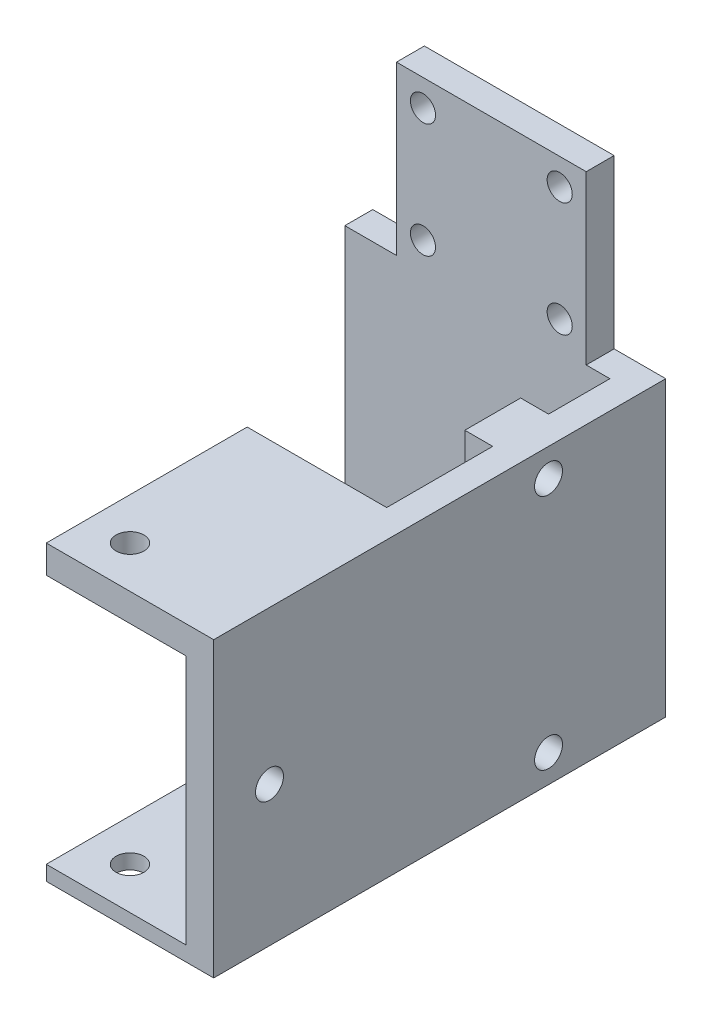
from build123d import *

# Parameters (mm, degrees)
SKETCH1_R               = 2.25
BOSS_EXTRUDE1_DEPTH     = 5
SKETCH2_W               = 52.5
SKETCH2_H               = 52.5
SKETCH2_W_2             = 42.5
SKETCH2_H_2             = 42.5
BOSS_EXTRUDE2_DEPTH     = 40
BOSS_EXTRUDE3_DEPTH     = 36
CUT_EXTRUDE2_DEPTH      = 121.157448791
CUT_EXTRUDE2_DEPTH_BACK = 121.157448791
SKETCH6_R               = 2.5
CUT_EXTRUDE3_DEPTH      = 149.234611343
CUT_EXTRUDE3_DEPTH_BACK = 149.234611343
SKETCH7_R               = 2.5
SKETCH8_W               = 40
SKETCH8_H               = 36.5
CUT_EXTRUDE4_DEPTH      = 24
SKETCH9_W               = 25
SKETCH9_H               = 25.519409936
CUT_EXTRUDE5_DEPTH      = 2.35
SKETCH10_W              = 5
SKETCH10_H              = 30
CUT_EXTRUDE6_DEPTH      = 119
SKETCH11_W              = 40
SKETCH11_H              = 52.5
CUT_EXTRUDE7_DEPTH      = 47.5
SKETCH12_R              = 2.5
CUT_EXTRUDE8_DEPTH      = 119
BOSS_EXTRUDE4_START     = 5
SKETCH13_W              = 10
SKETCH13_H              = 52.5
SKETCH13_R              = 2.5
BOSS_EXTRUDE4_DEPTH     = 5


with BuildPart() as part:
    # Sketch1 → Boss-Extrude1 (new body)
    with BuildSketch(Plane.XY):
        Polygon((0, 30), (-9.25, 30), (-9.25, 82.5), (0, 82.5), (0, 112.5), (34, 112.5), (34, 82.5), (43.25, 82.5), (43.25, 30), (34, 30), (34, 0), (0, 0), align=None)
        with Locations((4.75, 25.25)):
            Circle(SKETCH1_R, mode=Mode.SUBTRACT)
        with Locations((29.25, 25.25)):
            Circle(SKETCH1_R, mode=Mode.SUBTRACT)
        with Locations((29.25, 4.75)):
            Circle(SKETCH1_R, mode=Mode.SUBTRACT)
        with Locations((4.75, 4.75)):
            Circle(SKETCH1_R, mode=Mode.SUBTRACT)
        with Locations((4.75, 107.75)):
            Circle(SKETCH1_R, mode=Mode.SUBTRACT)
        with Locations((29.25, 107.75)):
            Circle(SKETCH1_R, mode=Mode.SUBTRACT)
        with Locations((29.25, 87.25)):
            Circle(SKETCH1_R, mode=Mode.SUBTRACT)
        with Locations((4.75, 87.25)):
            Circle(SKETCH1_R, mode=Mode.SUBTRACT)
    extrude(amount=BOSS_EXTRUDE1_DEPTH)

    # Sketch2 → Boss-Extrude2 (add)
    with BuildSketch(Plane.XY.offset(5)):
        with Locations((17, 56.25)):
            Rectangle(SKETCH2_W, SKETCH2_H)
        with Locations((17, 56.25)):
            Rectangle(SKETCH2_W_2, SKETCH2_H_2, mode=Mode.SUBTRACT)
    extrude(amount=BOSS_EXTRUDE2_DEPTH)

    # Sketch5 → Boss-Extrude3 (add)
    with BuildSketch(Plane.XY.offset(45)):
        Polygon((43.25, 82.5), (43.25, 30), (13.25, 30), (13.25, 35), (38.25, 35), (38.25, 77.5), (13.25, 77.5), (13.25, 82.5), align=None)
    extrude(amount=BOSS_EXTRUDE3_DEPTH)

    # Sketch6 → Cut-Extrude2 (cut, two sides: drawn at the far end of the back side and taken through both)
    with BuildSketch(Plane.XZ.offset(-77.5).offset(-CUT_EXTRUDE2_DEPTH_BACK)):
        with Locations(Location((20.75, 73.5, 0), (0, 0, 270))):
            Circle(SKETCH6_R)
    extrude(amount=CUT_EXTRUDE2_DEPTH + CUT_EXTRUDE2_DEPTH_BACK, mode=Mode.SUBTRACT)

    # Sketch7 → Cut-Extrude3 (cut, two sides: drawn at the far end of the back side and taken through both)
    with BuildSketch(Plane(origin=(43.25, 0, 0), x_dir=(0, 0, -1), z_dir=(1, 0, 0)).offset(-CUT_EXTRUDE3_DEPTH_BACK)):
        with Locations(Location((-71, 55.075, 0), (0, 0, 90))):
            Circle(SKETCH7_R)
    extrude(amount=CUT_EXTRUDE3_DEPTH + CUT_EXTRUDE3_DEPTH_BACK, mode=Mode.SUBTRACT)

    # Sketch8 → Cut-Extrude4 (cut)
    with BuildSketch(Plane.ZY.offset(9.25)):
        with Locations((25, 56.25)):
            Rectangle(SKETCH8_W, SKETCH8_H)
    extrude(amount=-CUT_EXTRUDE4_DEPTH, mode=Mode.SUBTRACT)

    # Sketch9 → Cut-Extrude5 (cut)
    with BuildSketch(Plane(origin=(0, 35, 0), x_dir=(1, 0, 0), z_dir=(0, 1, 0))):
        with Locations((25.75, -68.240295032)):
            Rectangle(SKETCH9_W, SKETCH9_H)
    extrude(amount=-CUT_EXTRUDE5_DEPTH, mode=Mode.SUBTRACT)

    # Sketch10 → Cut-Extrude6 (cut)
    with BuildSketch(Plane.ZY):
        with Locations((2.5, 15)):
            Rectangle(SKETCH10_W, SKETCH10_H)
    extrude(amount=-CUT_EXTRUDE6_DEPTH, mode=Mode.SUBTRACT)

    # Sketch11 → Cut-Extrude7 (cut)
    with BuildSketch(Plane.ZY.offset(9.25)):
        with Locations((25, 56.25)):
            Rectangle(SKETCH11_W, SKETCH11_H)
    extrude(amount=-CUT_EXTRUDE7_DEPTH, mode=Mode.SUBTRACT)

    # Sketch12 → Cut-Extrude8 (cut)
    with BuildSketch(Plane.ZY.offset(-38.25)):
        with Locations(Location((21, 77.5, 0), (0, 0, 270))):
            Circle(SKETCH12_R)
        with Locations(Location((21, 35, 0), (0, 0, 270))):
            Circle(SKETCH12_R)
    extrude(amount=-CUT_EXTRUDE8_DEPTH, mode=Mode.SUBTRACT)

    # Sketch13 → Boss-Extrude4 (add)
    with BuildSketch(Plane.ZY.offset(-38.25).offset(BOSS_EXTRUDE4_START)):
        with Locations((21, 56.25)):
            Rectangle(SKETCH13_W, SKETCH13_H)
        with Locations(Location((21, 77.5, 0), (0, 0, 270))):
            Circle(SKETCH13_R, mode=Mode.SUBTRACT)
        with Locations(Location((21, 35, 0), (0, 0, 270))):
            Circle(SKETCH13_R, mode=Mode.SUBTRACT)
    extrude(amount=-BOSS_EXTRUDE4_DEPTH)


solid = part.part
